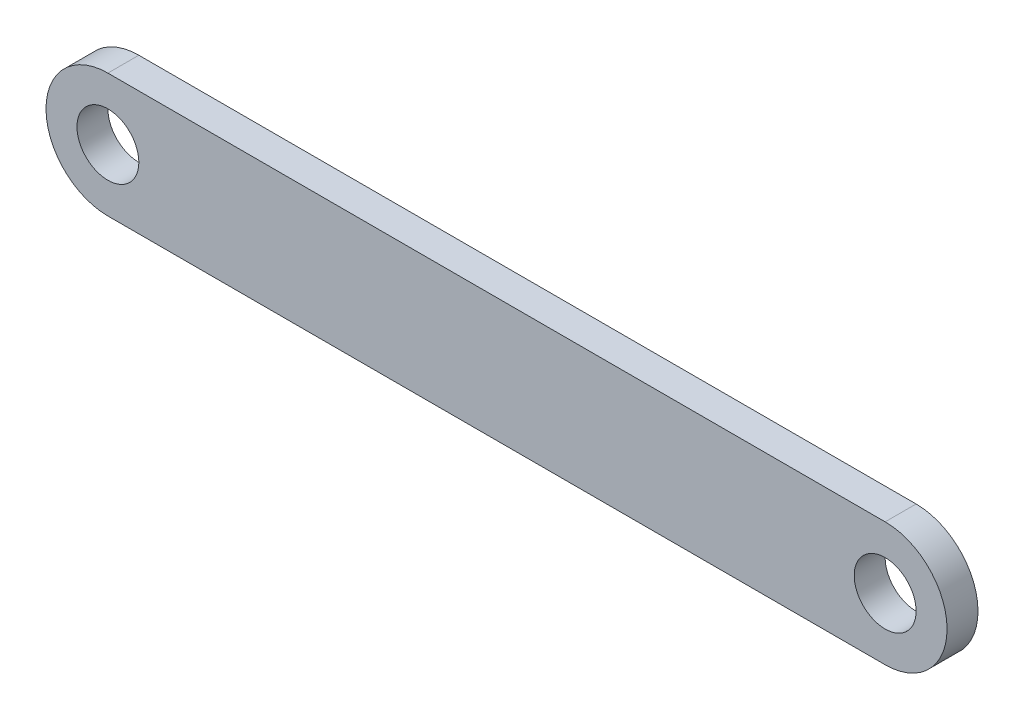
from build123d import *

# Parameters (mm, degrees)
SKETCH1_R      = 1
EXTRUDE1_DEPTH = 1


with BuildPart() as part:
    # Sketch1 → Extrude1 (new body)
    with BuildSketch(Plane.XY):
        with BuildLine():
            Line((0, 2), (-25.1163, 2))
            ThreePointArc((-25.1163, 2), (-27.1163, 0), (-25.1163, -2))
            Line((-25.1163, -2), (0, -2))
            ThreePointArc((0, -2), (2, 0), (0, 2))
        make_face()
        with Locations((-25.1163, 0)):
            Circle(SKETCH1_R, mode=Mode.SUBTRACT)
        Circle(SKETCH1_R, mode=Mode.SUBTRACT)
    extrude(amount=EXTRUDE1_DEPTH)


solid = part.part
